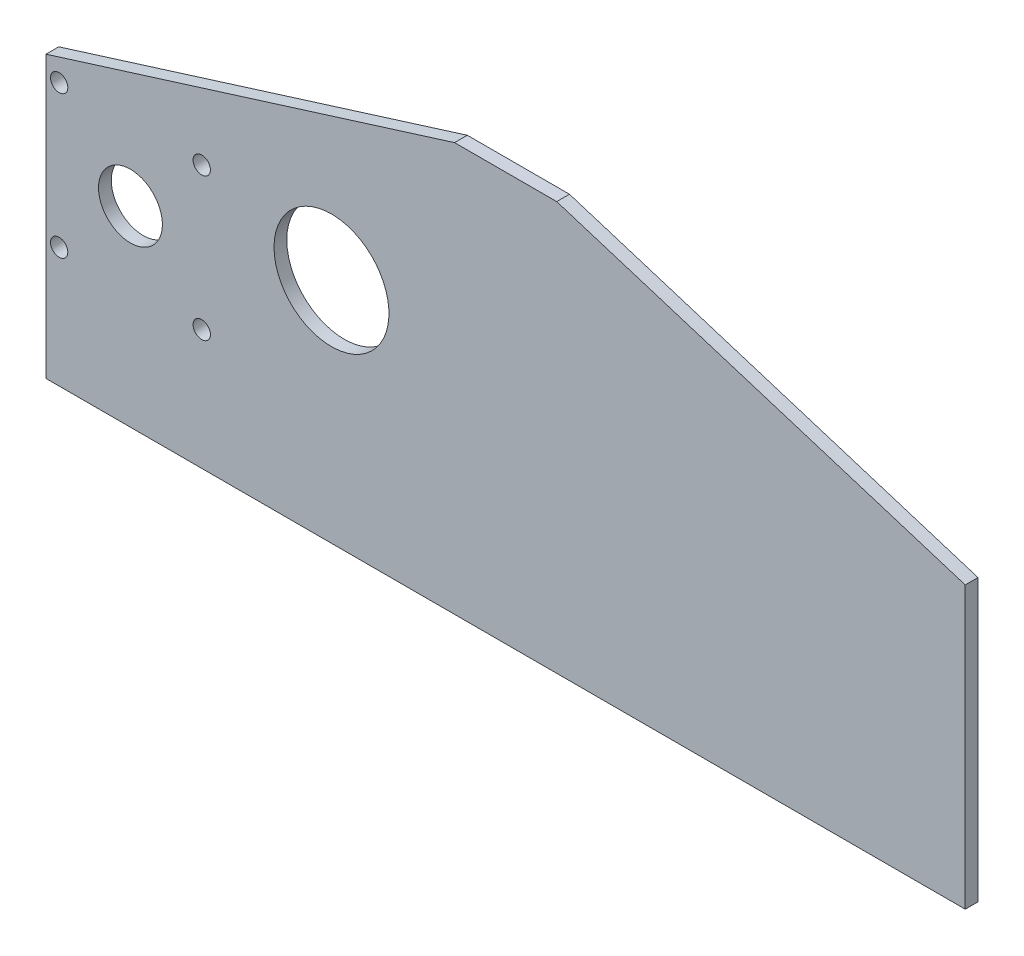
from build123d import *

# Parameters (mm, degrees)
BOSS_EXTRUDE1_DEPTH   = 3.175
SKETCH5_R             = 7.9375
CUT_EXTRUDE2_DEPTH    = 163.67034341
F_8_CLEARANCE_HOLE2_D = 4.3053
SKETCH8_R             = 14.2875
CUT_EXTRUDE3_DEPTH    = 163.67034341


with BuildPart() as part:
    # Sketch1 → Boss-Extrude1 (new body)
    with BuildSketch(Plane.XY):
        Polygon((0, 101.6), (-101.6, 69.85), (-101.6, 0), (0, 0), (127, 0), (127, 69.85), (25.4, 101.6), align=None)
    extrude(amount=BOSS_EXTRUDE1_DEPTH)

    # Sketch5 → Cut-Extrude2 (cut, through all)
    with BuildSketch(Plane(origin=(0, 0, 0), x_dir=(-1, 0, 0), z_dir=(0, 0, -1))):
        with Locations((80.6, 47.625)):
            Circle(SKETCH5_R)
    extrude(amount=-CUT_EXTRUDE2_DEPTH, mode=Mode.SUBTRACT)

    # #8 Clearance Hole2 (through all)
    with Locations(Plane(origin=(0, 0, 0), x_dir=(-1, 0, 0), z_dir=(0, 0, -1))):
        with Locations((80.6, 47.625), (98.33, 29.895), (62.87, 65.355), (62.87, 29.895), (98.33, 65.355)):
            Hole(F_8_CLEARANCE_HOLE2_D / 2)

    # Sketch8 → Cut-Extrude3 (cut, through all)
    with BuildSketch(Plane(origin=(0, 0, 0), x_dir=(-1, 0, 0), z_dir=(0, 0, -1))):
        with Locations((30.607, 56.643866392)):
            Circle(SKETCH8_R)
    extrude(amount=-CUT_EXTRUDE3_DEPTH, mode=Mode.SUBTRACT)


solid = part.part
